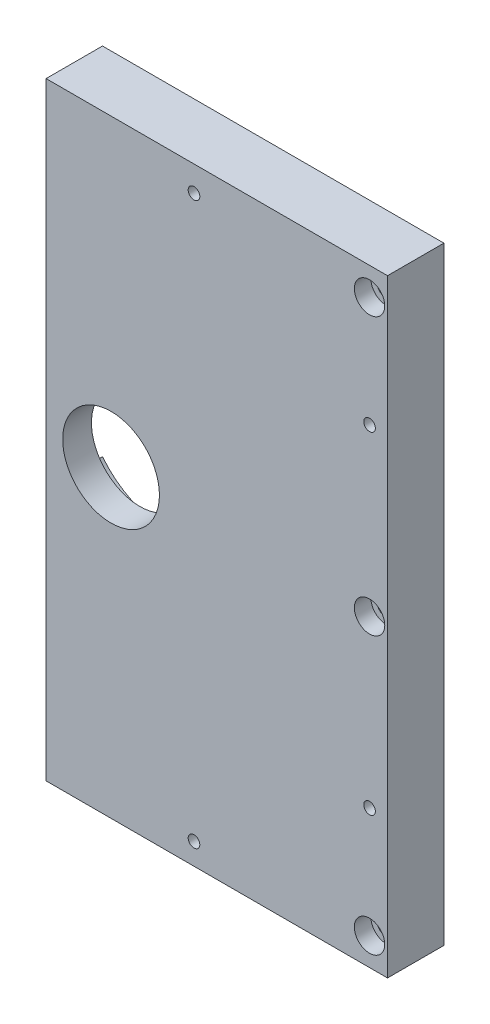
from build123d import *

# Parameters (mm, degrees)
RESSALTO_EXTRUS_O1_DEPTH          = 20.4
REBAIXO_PARA_SHCS_M61_D           = 6.6
REBAIXO_PARA_SHCS_M61_CBORE_D     = 11
REBAIXO_PARA_SHCS_M61_CBORE_DEPTH = 6
ESBO_O14_R                        = 17.5
RESSALTO_EXTRUS_O2_DEPTH          = 10.4
FURO_ROSCADO_DE_M5X0_81_D         = 4.2
FURO_ROSCADO_DE_M5X0_81_DEPTH     = 14
FURO_ROSCADO_DE_M5X0_81_TIP       = 1.2618073


with BuildPart() as part:
    # Esboço1 → Ressalto-extrusão1 (new body)
    with BuildSketch(Plane.XY):
        with BuildLine():
            Line((-23.5, 110), (100, 110))
            Line((100, 110), (100, -110))
            Line((100, -110), (-23.5, -110))
            Line((-23.5, -110), (-23.5, -18.648056199))
            ThreePointArc((-23.5, -18.648056199), (30, 0), (-23.5, 18.648056199))
            Line((-23.5, 18.648056199), (-23.5, 110))
        make_face()
    extrude(amount=RESSALTO_EXTRUS_O1_DEPTH)

    # Rebaixo para SHCS M61 (through all)
    with Locations(Plane.XY.offset(20.4)):
        with Locations((93.5, 100), (93.5, 0), (93.5, -100)):
            CounterBoreHole(REBAIXO_PARA_SHCS_M61_D / 2, REBAIXO_PARA_SHCS_M61_CBORE_D / 2, REBAIXO_PARA_SHCS_M61_CBORE_DEPTH)

    # Esboço14 → Ressalto-extrusão2 (add)
    with BuildSketch(Plane.XY.offset(10)):
        with BuildLine():
            Line((-23.5, -18.648056199), (-23.5, 18.648056199))
            ThreePointArc((-23.5, 18.648056199), (30, 0), (-23.5, -18.648056199))
        make_face()
        Circle(ESBO_O14_R, mode=Mode.SUBTRACT)
    extrude(amount=RESSALTO_EXTRUS_O2_DEPTH)

    # Furo roscado de M5x0.81
    with Locations(Plane.XY.offset(20.4)):
        with Locations((30, 100.827560784), (93.5, 60), (93.5, -60), (30, -102.194888391)):
            Hole(FURO_ROSCADO_DE_M5X0_81_D / 2, depth=FURO_ROSCADO_DE_M5X0_81_DEPTH)
            with Locations((0, 0, -(FURO_ROSCADO_DE_M5X0_81_DEPTH + FURO_ROSCADO_DE_M5X0_81_TIP / 2))):  # 118° drill point
                Cone(0, FURO_ROSCADO_DE_M5X0_81_D / 2, FURO_ROSCADO_DE_M5X0_81_TIP, mode=Mode.SUBTRACT)


solid = part.part
